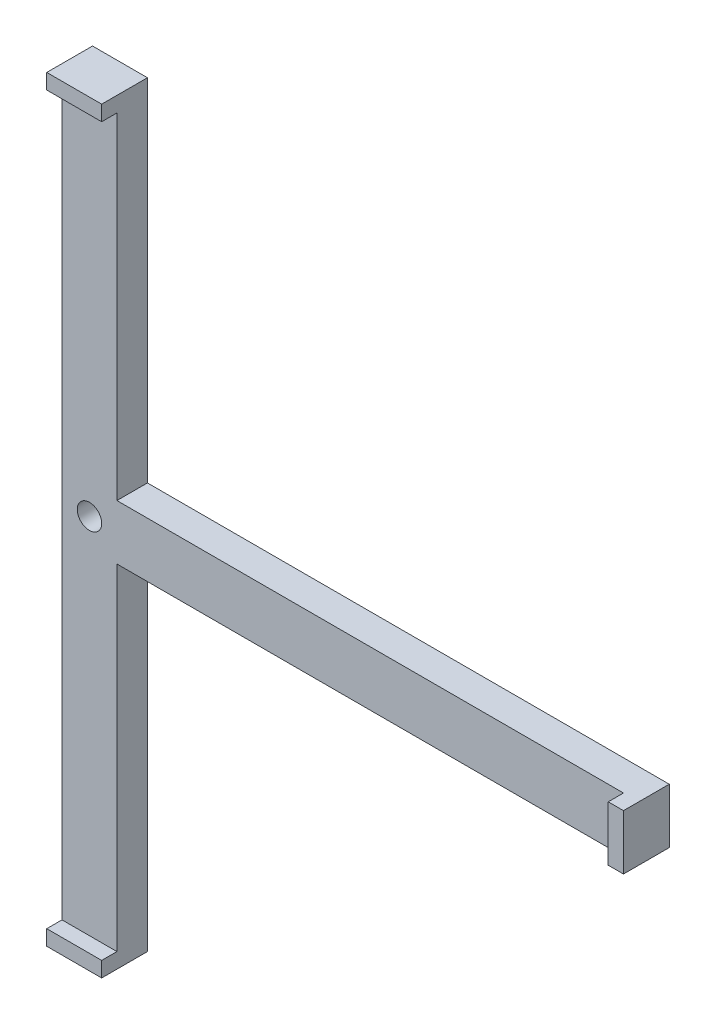
from build123d import *

# Parameters (mm, degrees)
SKETCH1_R           = 4
BOSS_EXTRUDE1_DEPTH = 10
SKETCH2_W           = 18
SKETCH2_H           = 5
SKETCH2_W_2         = 5
SKETCH2_H_2         = 18
BOSS_EXTRUDE2_DEPTH = 15


with BuildPart() as part:
    # Sketch1 → Boss-Extrude1 (new body)
    with BuildSketch(Plane.XY):
        Polygon((11.202614379, -118.751633987), (177.202614379, -118.751633987), (177.202614379, -100.751633987), (11.202614379, -100.751633987), (11.202614379, 9.248366013), (-6.797385621, 9.248366013), (-6.797385621, -228.751633987), (11.202614379, -228.751633987), align=None)
        with Locations((2.202614379, -109.751633987)):
            Circle(SKETCH1_R, mode=Mode.SUBTRACT)
    extrude(amount=BOSS_EXTRUDE1_DEPTH)

    # Sketch2 → Boss-Extrude2 (add)
    with BuildSketch(Plane(origin=(0, 0, 0), x_dir=(-1, 0, 0), z_dir=(0, 0, -1))):
        with Locations((-2.202614379, -231.251633987)):
            Rectangle(SKETCH2_W, SKETCH2_H)
        with Locations((-179.702614379, -109.751633987)):
            Rectangle(SKETCH2_W_2, SKETCH2_H_2)
        with Locations((-2.202614379, 11.748366013)):
            Rectangle(SKETCH2_W, SKETCH2_H)
    extrude(amount=-BOSS_EXTRUDE2_DEPTH)


solid = part.part
